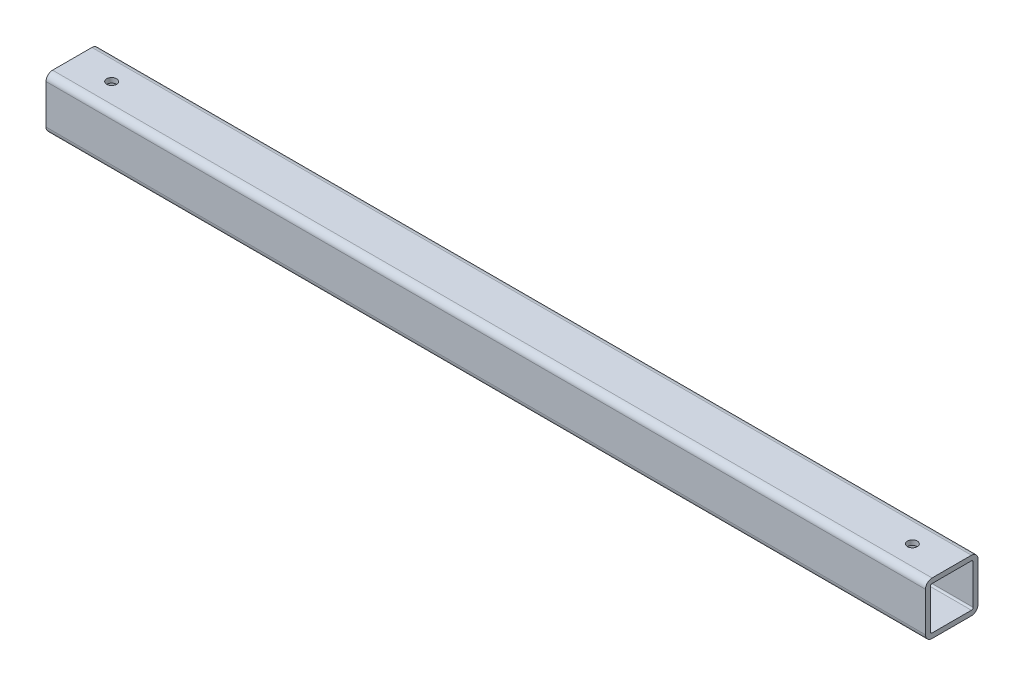
from build123d import *

# Parameters (mm, degrees)
BOSS_EXTRUDE1_DEPTH = 850.9
SKETCH2_R           = 4.7625
CUT_EXTRUDE1_DEPTH  = 850.9


with BuildPart() as part:
    # Sketch1 → Boss-Extrude1 (new body)
    with BuildSketch(Plane(origin=(0, 0, 0), x_dir=(0, 0, -1), z_dir=(1, 0, 0))):
        with BuildLine():
            Line((-6.35, 0), (-44.45, 0))
            ThreePointArc((-44.45, 0), (-48.940128061, 1.859871939), (-50.8, 6.35))
            Line((-50.8, 6.35), (-50.8, 44.45))
            ThreePointArc((-50.8, 44.45), (-48.940128061, 48.940128061), (-44.45, 50.8))
            Line((-44.45, 50.8), (-6.35, 50.8))
            ThreePointArc((-6.35, 50.8), (-1.859871939, 48.940128061), (0, 44.45))
            Line((0, 44.45), (0, 6.35))
            ThreePointArc((0, 6.35), (-1.859871939, 1.859871939), (-6.35, 0))
        make_face()
        with BuildLine():
            Line((-6.35, 4.699), (-44.45, 4.699))
            ThreePointArc((-44.45, 4.699), (-45.617433296, 5.182566704), (-46.101, 6.35))
            Line((-46.101, 6.35), (-46.101, 44.45))
            ThreePointArc((-46.101, 44.45), (-45.617433296, 45.617433296), (-44.45, 46.101))
            Line((-44.45, 46.101), (-6.35, 46.101))
            ThreePointArc((-6.35, 46.101), (-5.182566704, 45.617433296), (-4.699, 44.45))
            Line((-4.699, 44.45), (-4.699, 6.35))
            ThreePointArc((-4.699, 6.35), (-5.182566704, 5.182566704), (-6.35, 4.699))
        make_face(mode=Mode.SUBTRACT)
    extrude(amount=BOSS_EXTRUDE1_DEPTH)

    # Sketch2 → Cut-Extrude1 (cut)
    with BuildSketch(Plane(origin=(0, 50.8, 0), x_dir=(1, 0, 0), z_dir=(0, 1, 0))):
        with Locations((38.1, -25.4)):
            Circle(SKETCH2_R)
        with Locations((812.8, -25.4)):
            Circle(SKETCH2_R)
    extrude(amount=-CUT_EXTRUDE1_DEPTH, mode=Mode.SUBTRACT)


solid = part.part
